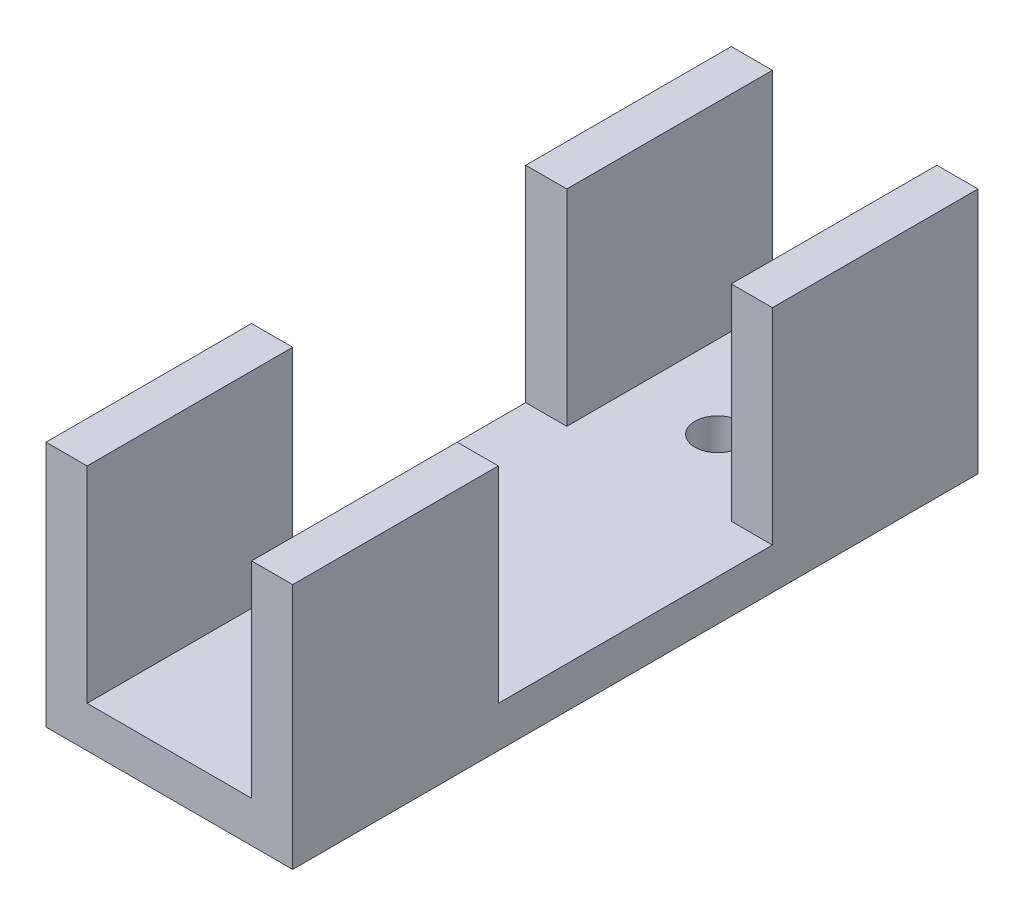
from build123d import *

# Parameters (mm, degrees)
SKETCH1_W           = 18
SKETCH1_H           = 50
BOSS_EXTRUDE1_DEPTH = 3
SKETCH2_W           = 3
SKETCH2_H           = 15
BOSS_EXTRUDE2_DEPTH = 15
SKETCH3_R           = 1.65
CUT_EXTRUDE1_DEPTH  = 3


with BuildPart() as part:
    # Sketch1 → Boss-Extrude1 (new body)
    with BuildSketch(Plane(origin=(0, 0, 0), x_dir=(1, 0, 0), z_dir=(0, 1, 0))):
        Rectangle(SKETCH1_W, SKETCH1_H)
    extrude(amount=BOSS_EXTRUDE1_DEPTH)

    # Sketch2 → Boss-Extrude2 (add)
    with BuildSketch(Plane(origin=(0, 3, 0), x_dir=(1, 0, 0), z_dir=(0, 1, 0))):
        with Locations((7.5, 17.5)):
            Rectangle(SKETCH2_W, SKETCH2_H)
        with Locations((-7.5, 17.5)):
            Rectangle(SKETCH2_W, SKETCH2_H)
        with Locations((-7.5, -17.5)):
            Rectangle(SKETCH2_W, SKETCH2_H)
        with Locations((7.5, -17.5)):
            Rectangle(SKETCH2_W, SKETCH2_H)
    extrude(amount=BOSS_EXTRUDE2_DEPTH)

    # Sketch3 → Cut-Extrude1 (cut)
    with BuildSketch(Plane.XZ):
        with Locations(Location((0, 15, 0), (0, 0, 270))):
            Circle(SKETCH3_R)
        with Locations(Location((0, -15, 0), (0, 0, 90))):
            Circle(SKETCH3_R)
    extrude(amount=-CUT_EXTRUDE1_DEPTH, mode=Mode.SUBTRACT)


solid = part.part
